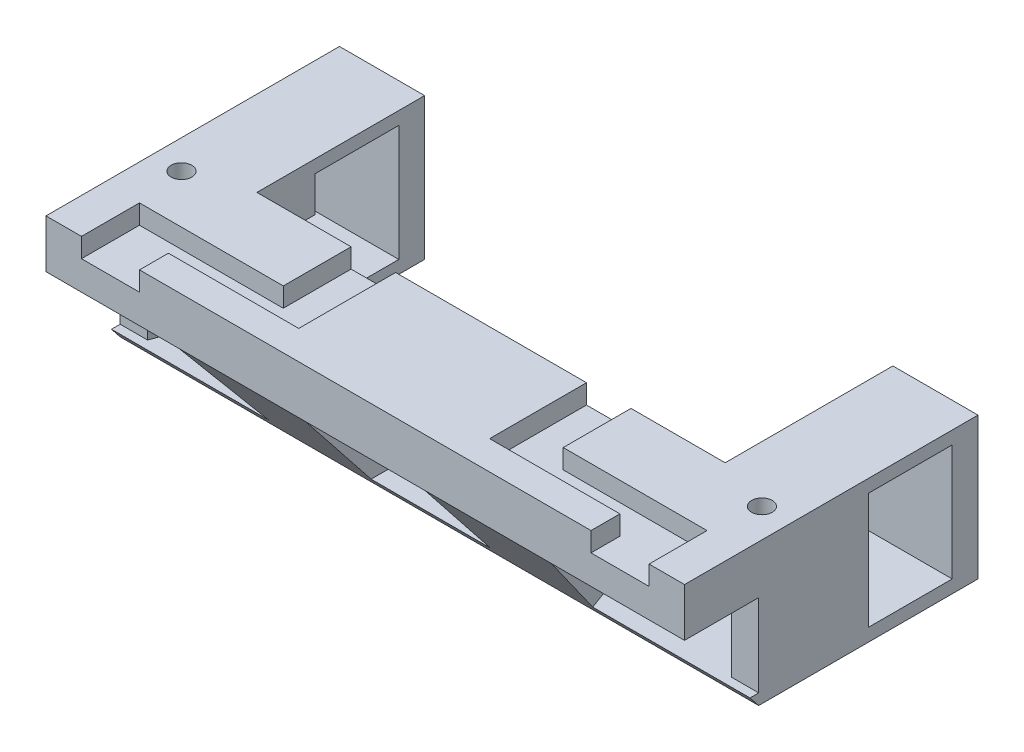
from build123d import *

# Parameters (mm, degrees)
CROQUIS1_W                  = 99
CROQUIS1_H                  = 49
SALIENTE_EXTRUIR1_DEPTH     = 22
CROQUIS2_W                  = 13
CROQUIS2_H                  = 18
CORTAR_EXTRUIR1_DEPTH       = 105.895766214
CROQUIS3_W                  = 3.5
CROQUIS3_H                  = 22
CORTAR_EXTRUIR2_DEPTH       = 105.895766214
CROQUIS4_W                  = 72.6
CROQUIS4_H                  = 26
CORTAR_EXTRUIR3_DEPTH       = 69.17620423
CORTAR_EXTRUIR4_DEPTH       = 79.584079892
CROQUIS7_W                  = 20.634922244
CROQUIS7_H                  = 12.8
CORTAR_EXTRUIR7_DEPTH       = 60
CROQUIS12_W                 = 20.6
CROQUIS12_H                 = 12.8
CORTAR_EXTRUIR8_DEPTH       = 60
CORTAR_EXTRUIR9_DEPTH       = 105.056653851
CORTAR_EXTRUIR9_DEPTH_BACK  = 105.056653851
CROQUIS16_W                 = 11.5
CROQUIS16_H                 = 12.8
CORTAR_EXTRUIR11_DEPTH      = 10
CROQUIS17_W                 = 11.5
CROQUIS17_H                 = 12.8
CORTAR_EXTRUIR12_DEPTH      = 10
CORTAR_EXTRUIR13_DEPTH      = 3
CORTAR_EXTRUIR14_DEPTH      = 69.17620423
CORTAR_EXTRUIR14_DEPTH_BACK = 69.17620423
CROQUIS20_R                 = 1.6


with BuildPart() as part:
    # Croquis1 → Saliente-Extruir1 (new body)
    with BuildSketch(Plane(origin=(0, 0, 0), x_dir=(1, 0, 0), z_dir=(0, 1, 0))):
        with Locations((10.676470588, -2.297794118)):
            Rectangle(CROQUIS1_W, CROQUIS1_H)
    extrude(amount=SALIENTE_EXTRUIR1_DEPTH)

    # Croquis2 → Cortar-Extruir1 (cut, through all)
    with BuildSketch(Plane.ZY.offset(38.823529412)):
        with Locations((-11.702205882, 11)):
            Rectangle(CROQUIS2_W, CROQUIS2_H)
    extrude(amount=-CORTAR_EXTRUIR1_DEPTH, mode=Mode.SUBTRACT)

    # Croquis3 → Cortar-Extruir2 (cut, through all)
    with BuildSketch(Plane.ZY.offset(38.823529412)):
        with Locations((25.047794118, 11)):
            Rectangle(CROQUIS3_W, CROQUIS3_H)
    extrude(amount=-CORTAR_EXTRUIR2_DEPTH, mode=Mode.SUBTRACT)

    # Croquis4 → Cortar-Extruir3 (cut, through all)
    with BuildSketch(Plane(origin=(0, 22, 0), x_dir=(1, 0, 0), z_dir=(0, 1, 0))):
        with Locations((10.676470588, 9.202205882)):
            Rectangle(CROQUIS4_W, CROQUIS4_H)
    extrude(amount=-CORTAR_EXTRUIR3_DEPTH, mode=Mode.SUBTRACT)

    # Croquis6 → Cortar-Extruir4 (cut, through all)
    with BuildSketch(Plane.XY.offset(23.297794118)):
        Polygon((19.926470588, 1.7), (19.926470588, 14.5), (1.426470588, 14.5), (1.426470588, 1.7), (10.676470588, 1.7), align=None)
    extrude(amount=-CORTAR_EXTRUIR4_DEPTH, mode=Mode.SUBTRACT)

    # Croquis7 → Cortar-Extruir7 (cut, along a direction that is not the sketch's normal)
    with BuildSketch(Plane.XY.offset(23.297794118)):
        with Locations((49.859009466, 8.1)):
            Rectangle(CROQUIS7_W, CROQUIS7_H)
    extrude(amount=-CORTAR_EXTRUIR7_DEPTH, dir=(0.346374082759158, 0, 0.9380964741393883), mode=Mode.SUBTRACT)

    # Croquis12 → Cortar-Extruir8 (cut, along a direction that is not the sketch's normal)
    with BuildSketch(Plane.XY.offset(23.297794118)):
        with Locations((-28.523529412, 8.1)):
            Rectangle(CROQUIS12_W, CROQUIS12_H)
    extrude(amount=-CORTAR_EXTRUIR8_DEPTH, dir=(-0.3463740827591596, 0, 0.9380964741393877), mode=Mode.SUBTRACT)

    # Croquis15 → Cortar-Extruir9 (cut, two sides: drawn at the far end of the back side and taken through both)
    with BuildSketch(Plane.ZY.offset(38.823529412).offset(-CORTAR_EXTRUIR9_DEPTH_BACK)):
        Polygon((23.297794118, 0), (11.797794118, 0), (23.297794118, 14.5), align=None)
    extrude(amount=CORTAR_EXTRUIR9_DEPTH + CORTAR_EXTRUIR9_DEPTH_BACK, mode=Mode.SUBTRACT)

    # Croquis16 → Cortar-Extruir11 (cut)
    with BuildSketch(Plane.ZY.offset(38.823529412)):
        with Locations((17.547794118, 8.1)):
            Rectangle(CROQUIS16_W, CROQUIS16_H)
    extrude(amount=-CORTAR_EXTRUIR11_DEPTH, mode=Mode.SUBTRACT)

    # Croquis17 → Cortar-Extruir12 (cut)
    with BuildSketch(Plane(origin=(60.176470588, 0, 0), x_dir=(0, 0, -1), z_dir=(1, 0, 0))):
        with Locations((-17.547794118, 8.1)):
            Rectangle(CROQUIS17_W, CROQUIS17_H)
    extrude(amount=-CORTAR_EXTRUIR12_DEPTH, mode=Mode.SUBTRACT)

    # Croquis18 → Cortar-Extruir13 (cut)
    with BuildSketch(Plane(origin=(0, 22, 0), x_dir=(1, 0, 0), z_dir=(0, 1, 0))):
        Polygon((-33.323529412, -23.297794118), (-24.323529412, -23.297794118), (-24.323529412, -18.818400103), (-4.120464629, -18.818400103), (-4.120464629, -3.797794118), (-11.023529412, -3.797794118), (-11.023529412, -14.307139366), (-33.323529412, -14.307139366), (-33.323529412, -18.818400103), align=None)
        Polygon((45.676470588, -18.818400103), (45.676470588, -23.297794118), (54.676470588, -23.297794118), (54.676470588, -18.818400103), (54.676470588, -14.307139366), (32.376470588, -14.307139366), (32.376470588, -3.797794118), (25.476470588, -3.797794118), (25.476470588, -18.818400103), align=None)
    extrude(amount=-CORTAR_EXTRUIR13_DEPTH, mode=Mode.SUBTRACT)

    # Croquis20 → Cortar-Extruir14 (cut, two sides: drawn at the far end of the back side and taken through both)
    with BuildSketch(Plane.XZ.offset(-CORTAR_EXTRUIR14_DEPTH_BACK)):
        with Locations(Location((-34.323529412, 6.797794118, 0), (0, 0, 270))):
            Circle(CROQUIS20_R)
        with Locations(Location((55.676470588, 6.797794118, 0), (0, 0, 270))):
            Circle(CROQUIS20_R)
    extrude(amount=CORTAR_EXTRUIR14_DEPTH + CORTAR_EXTRUIR14_DEPTH_BACK, mode=Mode.SUBTRACT)


solid = part.part
